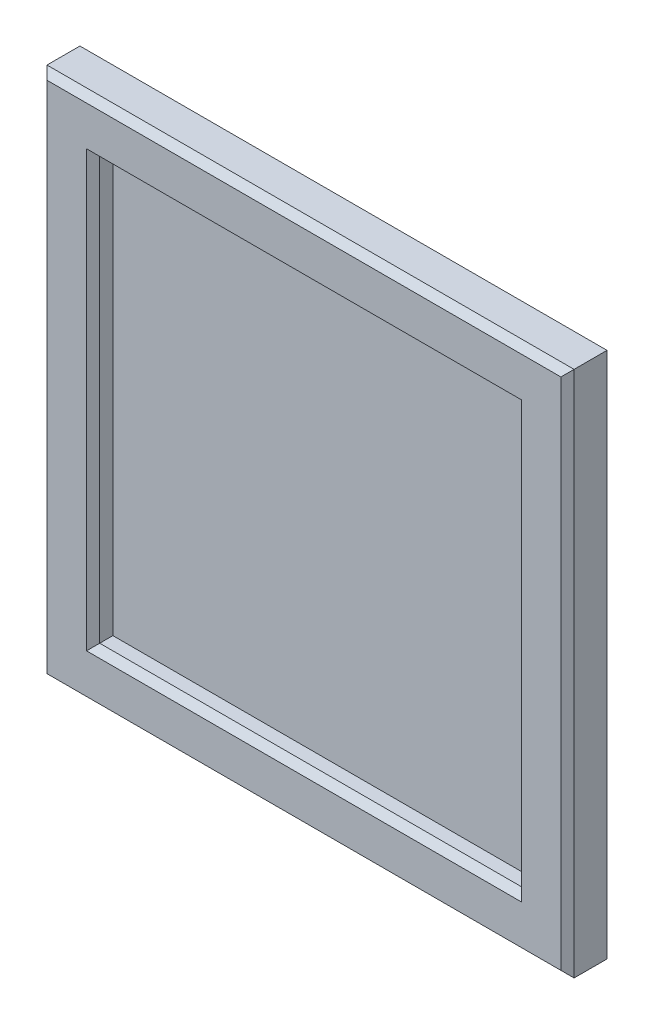
from build123d import *

# Parameters (mm, degrees)
SKETCH_1_W      = 800
SKETCH_1_H      = 800
SKETCH_1_W_2    = 640
SKETCH_1_H_2    = 640
EXTRUDE_1_DEPTH = 60
CHAMFER_1_SIZE  = 10
EXTRUDE_START   = -20
SKETCH_2_W      = 711.064877595
SKETCH_2_H      = 714.541967462
EXTRUDE_2_DEPTH = 10


with BuildPart() as part:
    # Эскиз1 → Бобышка-Вытянуть1 (new body)
    with BuildSketch(Plane.XY):
        with Locations((400, 400)):
            Rectangle(SKETCH_1_W, SKETCH_1_H)
        with Locations((400, 400)):
            Rectangle(SKETCH_1_W_2, SKETCH_1_H_2, mode=Mode.SUBTRACT)
    extrude(amount=EXTRUDE_1_DEPTH)

    # Фаска1
    chamfer_1_edges = [part.edges().sort_by_distance(p)[0] for p in [
        (800, 400, 60),
        (400, 80, 60),
        (400, 800, 60),
        (720, 400, 60),
        (400, 720, 60),
        (80, 400, 60),
        (0, 400, 60),
        (400, 0, 60),
    ]]
    chamfer(chamfer_1_edges, length=CHAMFER_1_SIZE)


with BuildPart() as body_2:
    # Эскиз2 → Бобышка-Вытянуть2 (new body)
    with BuildSketch(Plane(origin=(0, 0, 0), x_dir=(-1, 0, 0), z_dir=(0, 0, -1)).offset(EXTRUDE_START)):
        with Locations((-397.392182601, 394.784365201)):
            Rectangle(SKETCH_2_W, SKETCH_2_H)
    extrude(amount=-EXTRUDE_2_DEPTH)


solid = Compound([part.part, body_2.part])
